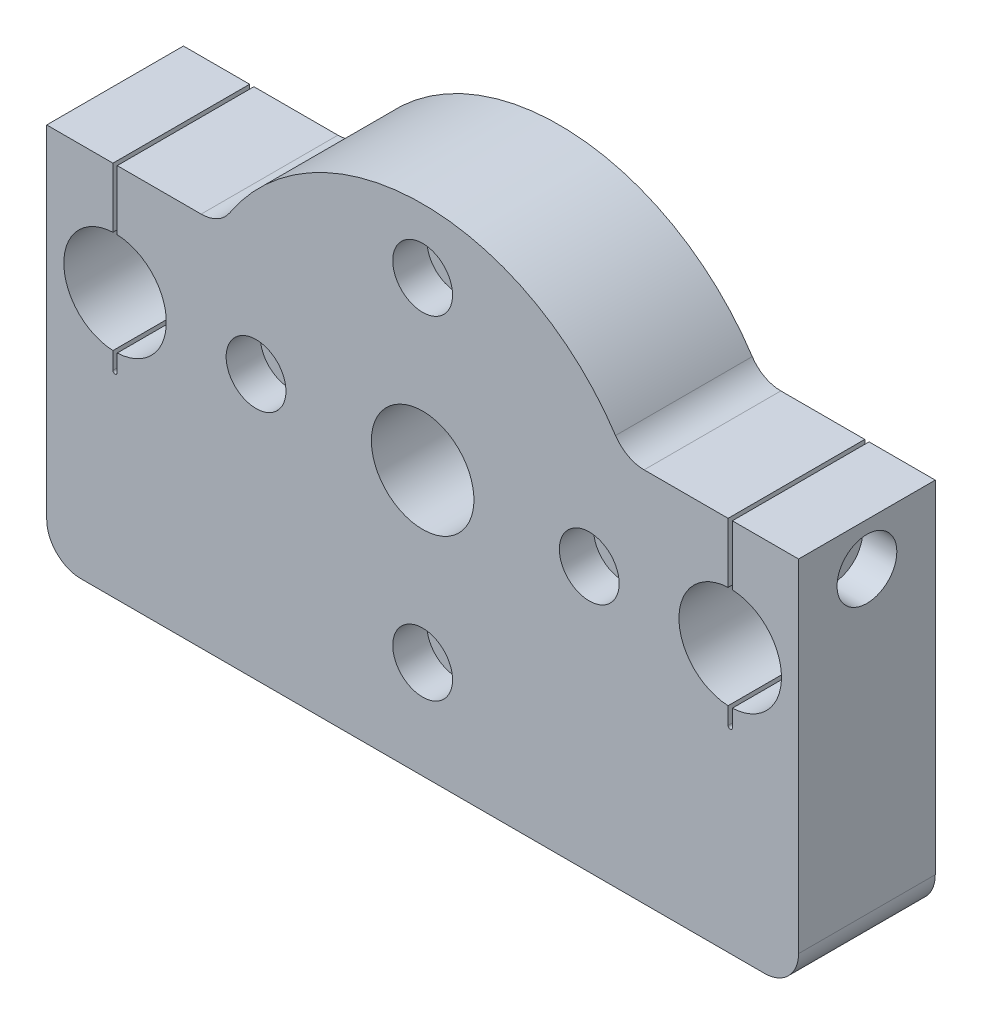
from build123d import *

# Parameters (mm, degrees)
BASE_DEPTH                            = 12.7
TUBE_COUNTERBORE_D                    = 6.7564
TUBE_COUNTERBORE_CBORE_D              = 11.1125
TUBE_COUNTERBORE_CBORE_DEPTH          = 6.35
TUBE_COUNTERBORE_PATTERN_COUNT        = 4
SKETCH8_R                             = 36.5125
STRUCTURE_TUBE_RECESS_DEPTH           = 7.62
SKETCH9_R                             = 9.525
LEAD_SCREW_THRU_HOLE_DEPTH            = 88.275546726
SKETCH13_R                            = 9.525
RAIL_BORE_PILOT_HOLE_DEPTH            = 90.140634148
SKETCH14_R                            = 2.38125
ALIGNMENT_FEATURES_DEPTH              = 6.35
GENERIC_ROUNDING_FILLET_R             = 6.35
SKETCH15_W                            = 0.79375
SKETCH15_H                            = 11.120771821
FLEXURE_SLITS_DEPTH                   = 90.140634148
FLEXURE_CLAMP_COUNTERBORE_D           = 6.7564
FLEXURE_CLAMP_COUNTERBORE_DEPTH       = 12.303125
FLEXURE_CLAMP_COUNTERBORE_CBORE_D     = 11.1125
FLEXURE_CLAMP_COUNTERBORE_CBORE_DEPTH = 6.35


with BuildPart() as part:
    # Bolt circle → Base (new, symmetric)
    with BuildSketch(Plane.XY):
        with BuildLine():
            Line((37.567106623, 20.6375), (69.85, 20.6375))
            Line((69.85, 20.6375), (69.85, -49.2125))
            Line((69.85, -49.2125), (-69.85, -49.2125))
            Line((-69.85, -49.2125), (-69.85, 20.6375))
            Line((-69.85, 20.6375), (-37.567106623, 20.6375))
            ThreePointArc((-37.567106623, 20.6375), (0, 42.8625), (37.567106623, 20.6375))
        make_face()
    extrude(amount=BASE_DEPTH, both=True)

    # Tube counterbore (through all)
    with Locations(Plane.XY.offset(12.7)):
        with Locations((0, 30.95625)):
            tube_counterbore = CounterBoreHole(TUBE_COUNTERBORE_D / 2, TUBE_COUNTERBORE_CBORE_D / 2, TUBE_COUNTERBORE_CBORE_DEPTH)

    # Tube counterbore pattern: Tube counterbore ×4 about axis
    tube_counterbore_pattern_axis = Axis((0, 0, 0), (0, 0, 1))
    for i in range(1, TUBE_COUNTERBORE_PATTERN_COUNT):
        add(tube_counterbore.rotate(tube_counterbore_pattern_axis, i * 360 / TUBE_COUNTERBORE_PATTERN_COUNT), mode=Mode.SUBTRACT)

    # Sketch8 → Structure_tube_recess (cut)
    with BuildSketch(Plane(origin=(0, 0, -12.7), x_dir=(-1, 0, 0), z_dir=(0, 0, -1))):
        Circle(SKETCH8_R)
    extrude(amount=-STRUCTURE_TUBE_RECESS_DEPTH, mode=Mode.SUBTRACT)

    # Sketch9 → Lead_screw_thru_hole (cut, through all)
    with BuildSketch(Plane(origin=(0, 0, -5.08), x_dir=(-1, 0, 0), z_dir=(0, 0, -1))):
        Circle(SKETCH9_R)
    extrude(amount=-LEAD_SCREW_THRU_HOLE_DEPTH, mode=Mode.SUBTRACT)

    # Sketch13 → Rail_bore_pilot_hole (cut, through all)
    with BuildSketch(Plane.XY.offset(12.7)):
        with Locations((57.15, 0)):
            Circle(SKETCH13_R)
        with Locations((-57.15, 0)):
            Circle(SKETCH13_R)
    extrude(amount=-RAIL_BORE_PILOT_HOLE_DEPTH, mode=Mode.SUBTRACT)

    # Sketch14 → Alignment_features (cut)
    with BuildSketch(Plane(origin=(0, 0, -5.08), x_dir=(-1, 0, 0), z_dir=(0, 0, -1))):
        with Locations((-21.889374295, -21.889374295)):
            Circle(SKETCH14_R)
        with BuildLine():
            Line((20.681324246, 24.089602852), (19.602797121, 22.924727111))
            ThreePointArc((19.602797121, 22.924727111), (19.732320046, 19.559622813), (23.097424344, 19.689145738))
            Line((23.097424344, 19.689145738), (24.175951469, 20.854021479))
            ThreePointArc((24.175951469, 20.854021479), (24.046428544, 24.219125777), (20.681324246, 24.089602852))
        make_face()
    extrude(amount=-ALIGNMENT_FEATURES_DEPTH, mode=Mode.SUBTRACT)

    # Generic_rounding_fillet
    generic_rounding_fillet_edges = [part.edges().sort_by_distance(p)[0] for p in [
        (37.567106623, 20.6375, 0),
        (69.85, -49.2125, 0),
        (-69.85, -49.2125, 0),
        (-37.567106623, 20.6375, 0),
    ]]
    fillet(generic_rounding_fillet_edges, radius=GENERIC_ROUNDING_FILLET_R)

    # Sketch15 → Flexure_slits (cut, through all)
    with BuildSketch(Plane(origin=(0, 0, -12.7), x_dir=(-1, 0, 0), z_dir=(0, 0, -1))):
        with BuildLine():
            Line((56.753125, -9.516728179), (56.753125, -12.7))
            ThreePointArc((56.753125, -12.7), (57.15, -13.096875), (57.546875, -12.7))
            Line((57.546875, -12.7), (57.546875, -9.516728179))
            ThreePointArc((57.546875, -9.516728179), (57.15, -9.525), (56.753125, -9.516728179))
        make_face()
        with Locations((57.15, 15.07711409)):
            Rectangle(SKETCH15_W, SKETCH15_H)
        with BuildLine():
            Line((-57.546875, -12.7), (-57.546875, -9.516728179))
            ThreePointArc((-57.546875, -9.516728179), (-57.15, -9.525), (-56.753125, -9.516728179))
            Line((-56.753125, -9.516728179), (-56.753125, -12.7))
            ThreePointArc((-56.753125, -12.7), (-57.15, -13.096875), (-57.546875, -12.7))
        make_face()
        with Locations((-57.15, 15.07711409)):
            Rectangle(SKETCH15_W, SKETCH15_H)
    extrude(amount=-FLEXURE_SLITS_DEPTH, mode=Mode.SUBTRACT)

    # Flexure_clamp_counterbore
    with Locations(Plane(origin=(-69.85, 5.772256362, 0.258118138), x_dir=(0, 0, 1), z_dir=(-1, 0, 0))):
        with Locations((-0.258118138, 6.927743638)):
            flexure_clamp_counterbore = CounterBoreHole(FLEXURE_CLAMP_COUNTERBORE_D / 2, FLEXURE_CLAMP_COUNTERBORE_CBORE_D / 2, FLEXURE_CLAMP_COUNTERBORE_CBORE_DEPTH, depth=FLEXURE_CLAMP_COUNTERBORE_DEPTH)

    # Sketch18 → Flexure_clamp_threads (revolve, cut)
    with BuildSketch(Plane(origin=(-56.753125, 12.7, 0), x_dir=(0, 0, 1), z_dir=(0, 1, 0))):
        Polygon((0, 0), (0, 18.043816902), (2.5527, 16.51), (2.5527, 0), align=None)
    flexure_clamp_threads = revolve(axis=Axis((-63.103125, 12.7, 0), (1, 0, 0)), mode=Mode.SUBTRACT)

    # Flexure_clamp_fastener_holes: Flexure_clamp_counterbore, Flexure_clamp_threads across plane
    add(flexure_clamp_counterbore.mirror(Plane(origin=(0, 0, 0), x_dir=(0, 0, 1), z_dir=(1, 0, 0))), mode=Mode.SUBTRACT)
    add(flexure_clamp_threads.mirror(Plane(origin=(0, 0, 0), x_dir=(0, 0, 1), z_dir=(1, 0, 0))), mode=Mode.SUBTRACT)


solid = part.part
